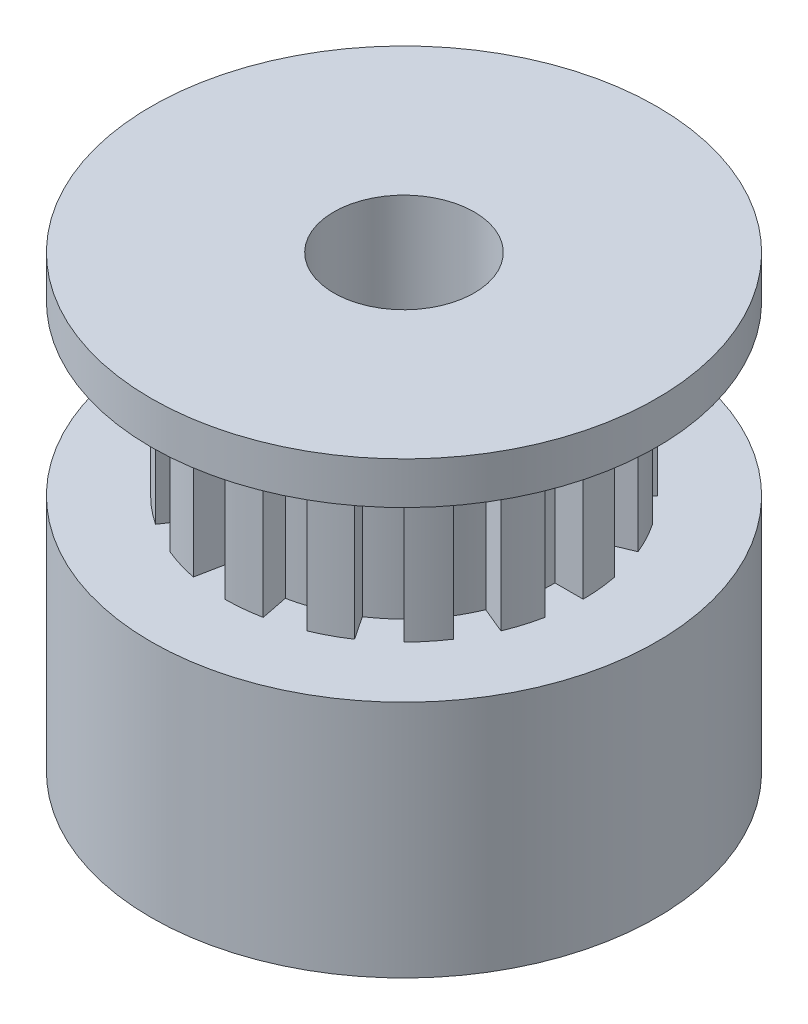
from build123d import *

# Parameters (mm, degrees)
SKETCH1_W          = 6.5
SKETCH1_H          = 16
CUT_EXTRUDE1_START = -7.5
CUT_EXTRUDE1_DEPTH = 6
CIRPATTERN1_COUNT  = 16


with BuildPart() as part:
    # Sketch1 → Revolve1 (revolve)
    with BuildSketch(Plane.XY, mode=Mode.PRIVATE) as revolve1_sk:
        with Locations((-5.75, 8)):
            Rectangle(SKETCH1_W, SKETCH1_H)
    revolve(revolve1_sk.sketch.rotate(Axis((0, 0, 0), (0, 1, 0)), 270), axis=Axis((0, 0, 0), (0, 1, 0)))

    # Sketch2 → Cut-Extrude1 (cut)
    with BuildSketch(Plane(origin=(0, 16, 0), x_dir=(1, 0, 0), z_dir=(0, 1, 0)).offset(CUT_EXTRUDE1_START)):
        with BuildLine():
            Line((1.048890586, -5.273129068), (1.243980908, -6.253914348))
            ThreePointArc((1.243980908, -6.253914348), (0.625, -6.345731492), (0, -6.376435773))
            Line((0, -6.376435773), (0, -9))
            ThreePointArc((0, -9), (1.755812898, -8.827067524), (3.444150891, -8.314915793))
            Line((3.444150891, -8.314915793), (2.440156328, -5.891058501))
            Line((2.440156328, -5.891058501), (2.057472896, -4.967178969))
            ThreePointArc((2.057472896, -4.967178969), (1.560696923, -5.144928254), (1.048890586, -5.273129068))
        make_face()
    cut_extrude1 = extrude(amount=CUT_EXTRUDE1_DEPTH, mode=Mode.SUBTRACT)

    # CirPattern1: Cut-Extrude1 ×16 about axis
    cirpattern1_axis = Axis((0, 0, 0), (0, 1, 0))
    for i in range(1, CIRPATTERN1_COUNT):
        add(cut_extrude1.rotate(cirpattern1_axis, i * 360 / CIRPATTERN1_COUNT), mode=Mode.SUBTRACT)


solid = part.part
